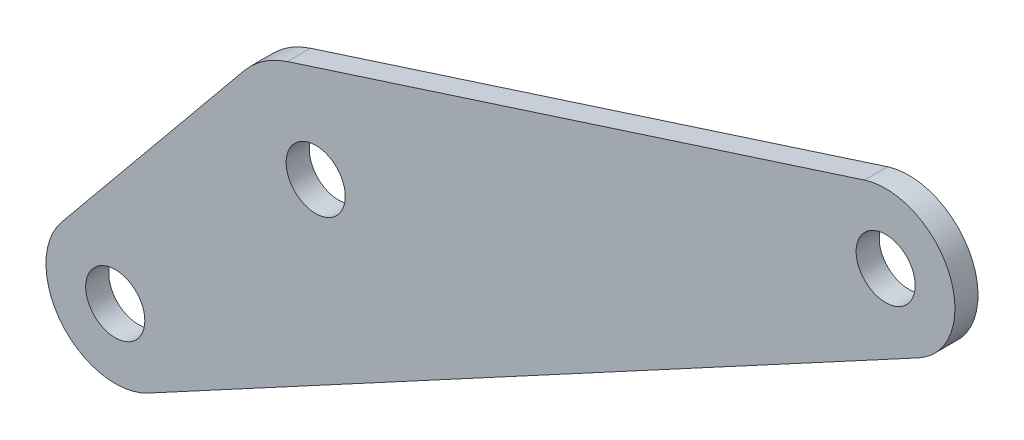
from build123d import *

# Parameters (mm, degrees)
SKETCH1_R           = 2.032
BOSS_EXTRUDE1_DEPTH = 1.5875


with BuildPart() as part:
    # Sketch1 → Boss-Extrude1 (new body)
    with BuildSketch(Plane.XY):
        with BuildLine():
            Line((-17.46091594, -11.266145515), (-4.908554587, 4.028472646))
            ThreePointArc((-4.908554587, 4.028472646), (-3.57279548, 5.249536404), (-1.946831272, 6.044199533))
            Line((-1.946831272, 6.044199533), (37.719376546, 18.82064965))
            ThreePointArc((37.719376546, 18.82064965), (43.560091213, 16.156143057), (41.440995839, 10.096194378))
            Line((41.440995839, 10.096194378), (-11.518004161, -18.478805622))
            ThreePointArc((-11.518004161, -18.478805622), (-17.455048902, -17.315989148), (-17.46091594, -11.266145515))
        make_face()
        Circle(SKETCH1_R, mode=Mode.SUBTRACT)
        with Locations((-13.7795, -14.2875)):
            Circle(SKETCH1_R, mode=Mode.SUBTRACT)
        with Locations((39.1795, 14.2875)):
            Circle(SKETCH1_R, mode=Mode.SUBTRACT)
    extrude(amount=BOSS_EXTRUDE1_DEPTH)


solid = part.part
